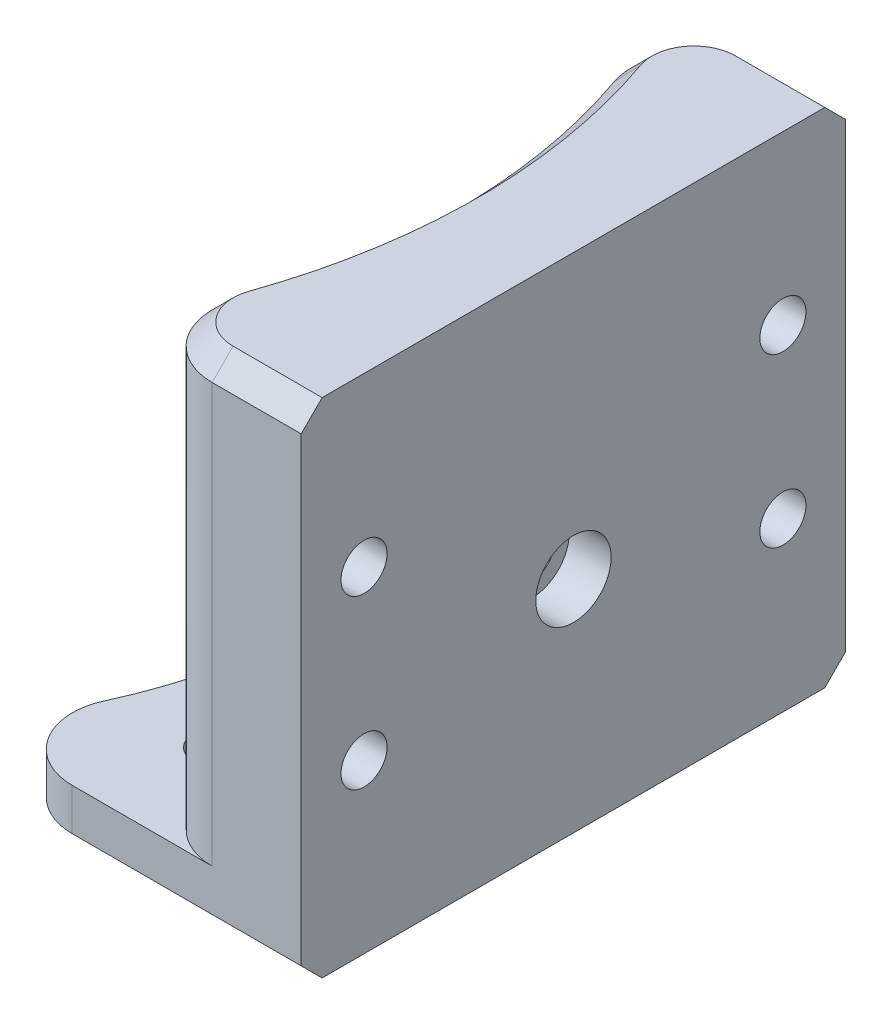
from build123d import *

# Parameters (mm, degrees)
SKETCH_1_R          = 1.1
EXTRUDE_1_DEPTH     = 24
SKETCH_2_R          = 27.2
CUT_EXTRUDE_1_DEPTH = 21
FILLET_1_R          = 3
SKETCH_3_R          = 1.1
CUT_EXTRUDE_2_DEPTH = 31.645010485
CHAMFER_2_SIZE      = 1
CUT_EXTRUDE_3_DEPTH = 28.75
SKETCH_5_R          = 1.8
CUT_EXTRUDE_4_DEPTH = 2
SKETCH_6_R          = 1.8
CUT_EXTRUDE_5_DEPTH = 1


with BuildPart() as part:
    # Эскиз1 → Бобышка-Вытянуть1 (new body)
    with BuildSketch(Plane(origin=(0, 0, 0), x_dir=(1, 0, 0), z_dir=(0, 1, 0))):
        with BuildLine():
            Line((32.75, 13), (16.492422502, 13))
            ThreePointArc((16.492422502, 13), (19.841129914, 6.879648517), (21, 0))
            ThreePointArc((21, 0), (19.841129914, -6.879648517), (16.492422502, -13))
            Line((16.492422502, -13), (32.75, -13))
            Line((32.75, -13), (32.75, 13))
        make_face()
        with Locations(Location((23.685438565, -8, 0), (0, 0, 270))):
            Circle(SKETCH_1_R, mode=Mode.SUBTRACT)
        with Locations(Location((23.685438565, 8, 0), (0, 0, 270))):
            Circle(SKETCH_1_R, mode=Mode.SUBTRACT)
    extrude(amount=EXTRUDE_1_DEPTH)

    # Эскиз2 → Вырез-Вытянуть1 (cut)
    with BuildSketch(Plane(origin=(0, 24, 0), x_dir=(1, 0, 0), z_dir=(0, 1, 0))):
        Circle(SKETCH_2_R)
    extrude(amount=-CUT_EXTRUDE_1_DEPTH, mode=Mode.SUBTRACT)

    # Скругление1
    fillet_1_edges = [part.edges().sort_by_distance(p)[0] for p in [
        (16.492422502, 1.5, -13),
        (16.492422502, 1.5, 13),
        (23.89225816, 13.5, 13),
        (23.89225816, 13.5, -13),
    ]]
    fillet(fillet_1_edges, radius=FILLET_1_R)

    # Эскиз3 → Вырез-Вытянуть2 (cut, through all)
    with BuildSketch(Plane(origin=(32.75, 0, 0), x_dir=(0, 0, -1), z_dir=(1, 0, 0))):
        with Locations((0, 10.5)):
            Circle(SKETCH_3_R)
        with Locations((-10, 16)):
            Circle(SKETCH_3_R)
        with Locations((-10, 8)):
            Circle(SKETCH_3_R)
        with Locations(Location((10, 8, 0), (0, 0, 205.43535128))):
            Circle(SKETCH_3_R)
        with Locations(Location((10, 16, 0), (0, 0, 205.43535128))):
            Circle(SKETCH_3_R)
    extrude(amount=-CUT_EXTRUDE_2_DEPTH, mode=Mode.SUBTRACT)

    # Фаска2
    chamfer_2_edges = [part.edges().sort_by_distance(p)[0] for p in [
        (30.623157776, 24, 13),
        (27.283712115, 0, 13),
        (27.2, 24, 0),
        (30.623157776, 24, -13),
        (26.048854372, 24, -11.734916071),
        (26.048854372, 24, 11.734916071),
        (27.283712115, 0, -13),
        (21, 0, 0),
        (19.292547995, 0, 11.620185175),
        (19.292547995, 0, -11.620185175),
    ]]
    chamfer(chamfer_2_edges, length=CHAMFER_2_SIZE)

    # Эскиз4 → Вырез-Вытянуть3 (cut)
    with BuildSketch(Plane(origin=(0, 0, 0), x_dir=(0, 0, -1), z_dir=(1, 0, 0))):
        Polygon((-8, 14.845299462), (-8, 17.154700538), (-10, 18.309401077), (-12, 17.154700538), (-12, 14.845299462), (-10, 13.690598923), align=None)
        Polygon((-10, 10.309401077), (-8, 9.154700538), (-8, 6.845299462), (-10, 5.690598923), (-12, 6.845299462), (-12, 9.154700538), align=None)
        Polygon((8, 9.154700538), (8, 6.845299462), (10, 5.690598923), (12, 6.845299462), (12, 9.154700538), (10, 10.309401077), align=None)
        Polygon((10, 13.690598923), (8, 14.845299462), (8, 17.154700538), (10, 18.309401077), (12, 17.154700538), (12, 14.845299462), align=None)
    extrude(amount=CUT_EXTRUDE_3_DEPTH, mode=Mode.SUBTRACT)

    # Эскиз5 → Вырез-Вытянуть4 (cut)
    with BuildSketch(Plane(origin=(32.75, 0, 0), x_dir=(0, 0, -1), z_dir=(1, 0, 0))):
        with Locations((0, 10.5)):
            Circle(SKETCH_5_R)
    extrude(amount=-CUT_EXTRUDE_4_DEPTH, mode=Mode.SUBTRACT)

    # Эскиз6 → Вырез-Вытянуть5 (cut)
    with BuildSketch(Plane.XZ):
        with Locations(Location((23.685438565, 8, 0), (0, 0, 270))):
            Circle(SKETCH_6_R)
        with Locations(Location((23.685438565, -8, 0), (0, 0, 270))):
            Circle(SKETCH_6_R)
    extrude(amount=-CUT_EXTRUDE_5_DEPTH, mode=Mode.SUBTRACT)


solid = part.part
